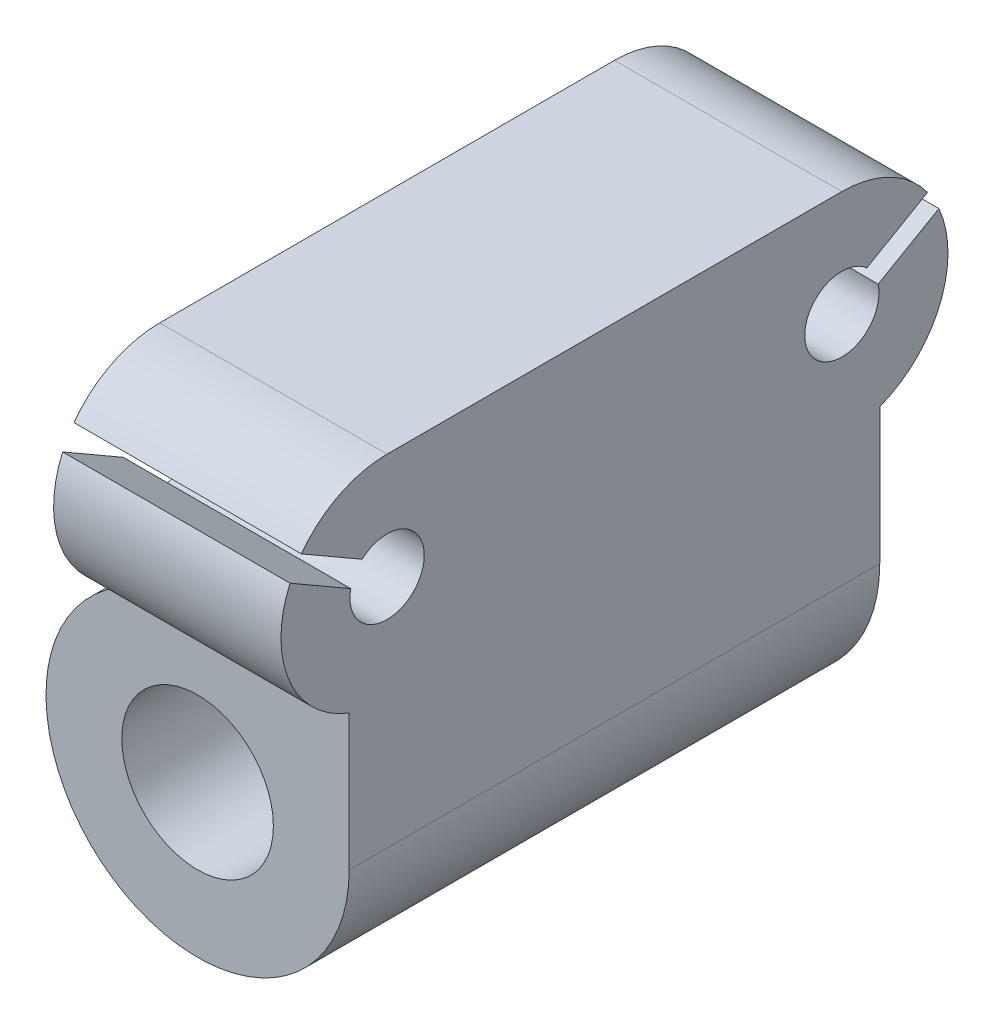
from build123d import *

# Parameters (mm, degrees)
SKETCH1_R                = 5
BOSS_EXTRUDE1_DEPTH      = 15
SKETCH3_R                = 3.5
BOSS_EXTRUDE2_DEPTH      = 5
SKETCH4_R                = 5
BOSS_EXTRUDE3_DEPTH      = 15
BOSS_EXTRUDE4_DEPTH      = 5
BOSS_EXTRUDE4_DEPTH_BACK = 10
SKETCH7_R                = 2.45
CUT_EXTRUDE1_DEPTH       = 48.86961474
CUT_EXTRUDE2_DEPTH       = 50.663870332


with BuildPart() as part:
    # Sketch1 → Boss-Extrude1 (new body)
    with BuildSketch(Plane.XY):
        with BuildLine():
            Line((0, 12), (10, 12))
            Line((10, 12), (10, 0))
            ThreePointArc((10, 0), (-7.071067812, -7.071067812), (0, 10))
            Line((0, 10), (0, 12))
        make_face()
        Circle(SKETCH1_R, mode=Mode.SUBTRACT)
    extrude(amount=BOSS_EXTRUDE1_DEPTH)

    # Sketch3 → Boss-Extrude2 (add)
    with BuildSketch(Plane.XY.offset(15)):
        with BuildLine():
            Line((10, 0), (10, 12))
            Line((10, 12), (0, 12))
            Line((0, 12), (0, 10))
            ThreePointArc((0, 10), (-7.071067812, 7.071067812), (-10, 0))
            ThreePointArc((-10, 0), (0, -10), (10, 0))
        make_face()
        Circle(SKETCH3_R, mode=Mode.SUBTRACT)
    extrude(amount=BOSS_EXTRUDE2_DEPTH)

    # Sketch4 → Boss-Extrude3 (add)
    with BuildSketch(Plane.XY.offset(20)):
        with BuildLine():
            Line((0, 12), (10, 12))
            Line((10, 12), (10, 0))
            ThreePointArc((10, 0), (-7.071067812, -7.071067812), (0, 10))
            Line((0, 10), (0, 12))
        make_face()
        with Locations(Location((0, 0, 0), (0, 0, 180))):
            Circle(SKETCH4_R, mode=Mode.SUBTRACT)
    extrude(amount=BOSS_EXTRUDE3_DEPTH)

    # Sketch6 → Boss-Extrude4 (add, two sides: drawn at the far end of the back side and taken through both)
    with BuildSketch(Plane.ZY.offset(-BOSS_EXTRUDE4_DEPTH_BACK)):
        with BuildLine():
            Line((9.5, 22.5), (2.5, 22.5))
            ThreePointArc((2.5, 22.5), (-4.5, 15.5), (2.5, 8.5))
            Line((2.5, 8.5), (32.5, 8.5))
            ThreePointArc((32.5, 8.5), (39.5, 15.5), (32.5, 22.5))
            Line((32.5, 22.5), (25.5, 22.5))
            Line((25.5, 22.5), (9.5, 22.5))
        make_face()
    extrude(amount=BOSS_EXTRUDE4_DEPTH + BOSS_EXTRUDE4_DEPTH_BACK)

    # Sketch7 → Cut-Extrude1 (cut, through all)
    with BuildSketch(Plane.ZY.offset(5)):
        with Locations((2.5, 15.5)):
            Circle(SKETCH7_R)
        with Locations((32.5, 15.5)):
            Circle(SKETCH7_R)
    extrude(amount=-CUT_EXTRUDE1_DEPTH, mode=Mode.SUBTRACT)

    # Sketch8 → Cut-Extrude2 (cut, through all)
    with BuildSketch(Plane(origin=(10, 0, 0), x_dir=(0, 0, -1), z_dir=(1, 0, 0))):
        Polygon((-32.125, 16.149519053), (-32.875, 14.850480947), (-38.937177826, 18.350480947), (-38.187177826, 19.649519053), align=None)
        Polygon((-2.875, 16.149519053), (-2.125, 14.850480947), (3.937177826, 18.350480947), (3.187177826, 19.649519053), align=None)
    extrude(amount=-CUT_EXTRUDE2_DEPTH, mode=Mode.SUBTRACT)


solid = part.part
